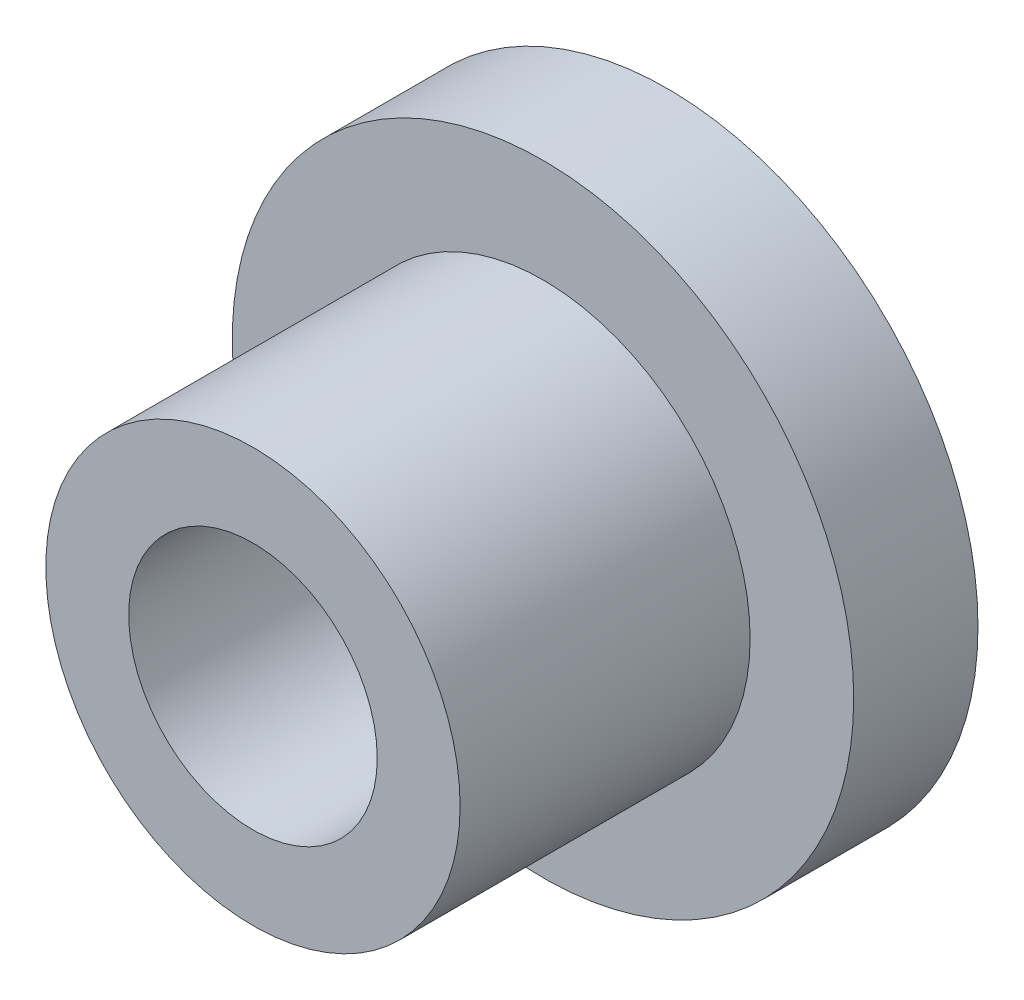
from build123d import *

# Parameters (mm, degrees)
SKETCH1_R           = 15
BOSS_EXTRUDE1_DEPTH = 6
SKETCH2_R           = 10
BOSS_EXTRUDE2_DEPTH = 14
SKETCH3_R           = 6
CUT_EXTRUDE1_DEPTH  = 30.154759474


with BuildPart() as part:
    # Sketch1 → Boss-Extrude1 (new body)
    with BuildSketch(Plane.XY):
        Circle(SKETCH1_R)
    extrude(amount=BOSS_EXTRUDE1_DEPTH)

    # Sketch2 → Boss-Extrude2 (add)
    with BuildSketch(Plane.XY.offset(6)):
        Circle(SKETCH2_R)
    extrude(amount=BOSS_EXTRUDE2_DEPTH)

    # Sketch3 → Cut-Extrude1 (cut, through all)
    with BuildSketch(Plane.XY.offset(20)):
        Circle(SKETCH3_R)
    extrude(amount=-CUT_EXTRUDE1_DEPTH, mode=Mode.SUBTRACT)


solid = part.part
